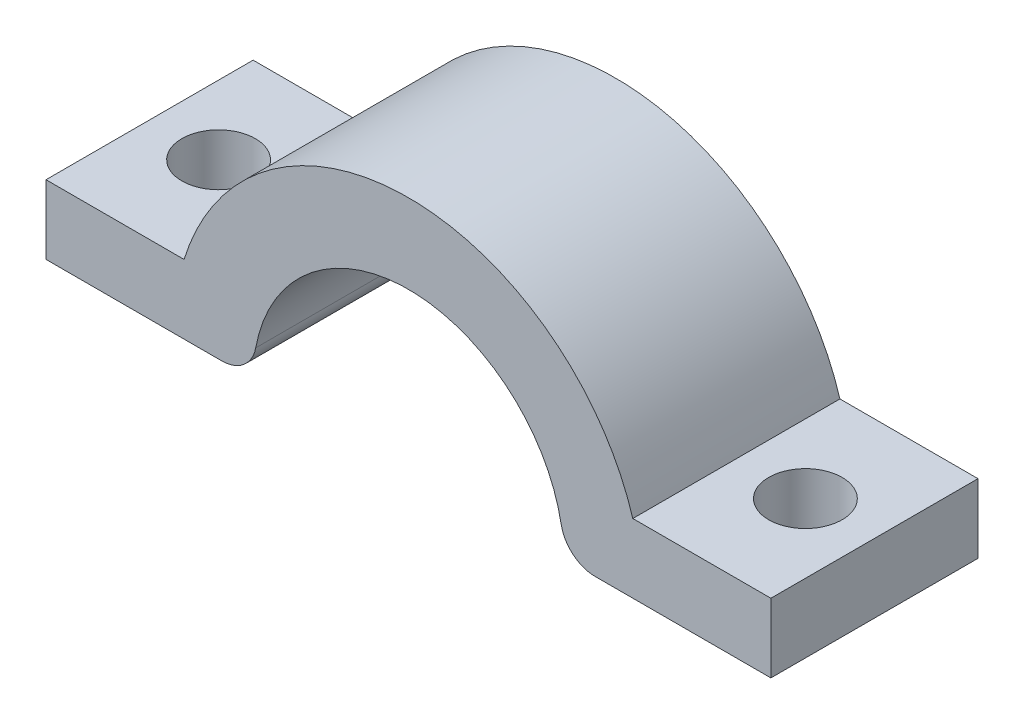
from build123d import *

# Parameters (mm, degrees)
BOSS_EXTRUDE1_DEPTH = 19.05
SKETCH2_R           = 3.3782
CUT_EXTRUDE1_DEPTH  = 42.311259545
FILLET1_R           = 3.175


with BuildPart() as part:
    # Sketch1 → Boss-Extrude1 (new body)
    with BuildSketch(Plane.XY):
        with BuildLine():
            Line((14.2875, 0), (33.3375, 0))
            Line((33.3375, 0), (33.3375, 6.35))
            Line((33.3375, 6.35), (20.6375, 6.35))
            ThreePointArc((20.6375, 6.35), (0, 21.592334433), (-20.6375, 6.35))
            Line((-20.6375, 6.35), (-33.3375, 6.35))
            Line((-33.3375, 6.35), (-33.3375, 0))
            Line((-33.3375, 0), (-14.2875, 0))
            ThreePointArc((-14.2875, 0), (0, 14.2875), (14.2875, 0))
        make_face()
    extrude(amount=BOSS_EXTRUDE1_DEPTH)

    # Sketch2 → Cut-Extrude1 (cut, through all)
    with BuildSketch(Plane(origin=(0, 6.35, 0), x_dir=(1, 0, 0), z_dir=(0, 1, 0))):
        with Locations(Location((26.9875, -9.525, 0), (0, 0, 180))):
            Circle(SKETCH2_R)
        with Locations(Location((-26.9875, -9.525, 0), (0, 0, 180))):
            Circle(SKETCH2_R)
    extrude(amount=-CUT_EXTRUDE1_DEPTH, mode=Mode.SUBTRACT)

    # Fillet1
    fillet1_edges = [part.edges().sort_by_distance(p)[0] for p in [
        (-14.2875, 0, 9.525),
        (14.2875, 0, 9.525),
    ]]
    fillet(fillet1_edges, radius=FILLET1_R)


solid = part.part
